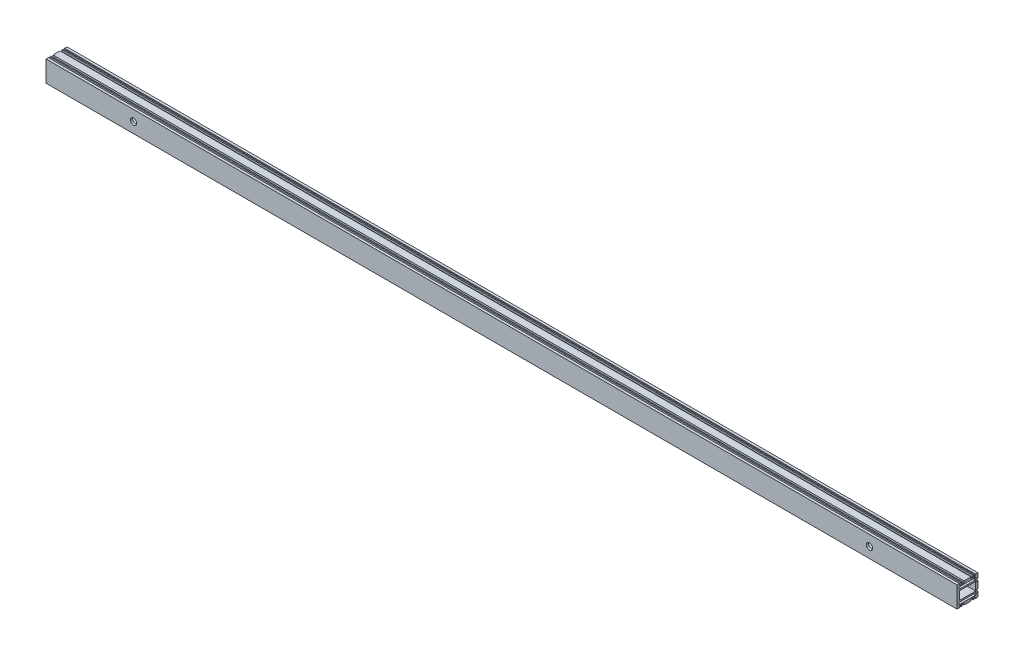
from build123d import *

# Parameters (mm, degrees)
SKETCH_1_W                = 23.5
SKETCH_1_H                = 12
EXTRUDE_1_DEPTH           = 650.5
HOLE_WIZARD_M6_1_D        = 5
HOLE_WIZARD_M6_1_DEPTH    = 19
HOLE_WIZARD_M6_1_TIP      = 1.502151548
HOLE_WIZARD_M6_2_D        = 5
HOLE_WIZARD_M6_2_DEPTH    = 19
HOLE_WIZARD_M6_2_TIP      = 1.502151548
HOLE_WIZARD_9_0_9_1_D     = 9
HOLE_WIZARD_7_0_7_1_D     = 7
HOLE_WIZARD_7_0_7_1_DEPTH = 15
HOLE_WIZARD_7_0_7_1_TIP   = 2.103012167
HOLE_WIZARD_M4_1_D        = 3.3
HOLE_WIZARD_M4_1_DEPTH    = 11.5
HOLE_WIZARD_M4_1_TIP      = 0.991420021


with BuildPart() as part:
    # 草图1 → 凸台-拉伸1 (new, symmetric)
    with BuildSketch(Plane(origin=(0, 0, 0), x_dir=(0, 0, -1), z_dir=(1, 0, 0))):
        Polygon((-15, 15), (-11.5, 15), (-11.5, 13.5), (-11, 13.5), (-11, 12), (-9.5, 12), (-9.5, 15), (-8, 15), (-8, 12.5), (-5, 12.5), (-5, 15), (5, 15), (5, 12.5), (8, 12.5), (8, 15), (9.5, 15), (9.5, 12), (11, 12), (11, 13.5), (11.5, 13.5), (11.5, 15), (15, 15), (15, 8), (12.5, 8), (12.5, 5), (15, 5), (15, -5), (12.5, -5), (12.5, -8), (15, -8), (15, -15), (11.5, -15), (11.5, -13.5), (11, -13.5), (11, -12), (9.5, -12), (9.5, -15), (8, -15), (8, -12.5), (5, -12.5), (5, -15), (-5, -15), (-5, -12.5), (-8, -12.5), (-8, -15), (-9.5, -15), (-9.5, -12), (-11, -12), (-11, -13.5), (-11.5, -13.5), (-11.5, -15), (-15, -15), align=None)
        with BuildLine():
            Line((12, -10.5), (12, -8.5))
            ThreePointArc((12, -8.5), (11.853553391, -8.146446609), (11.5, -8))
            Line((11.5, -8), (-11.5, -8))
            ThreePointArc((-11.5, -8), (-11.853553391, -8.146446609), (-12, -8.5))
            Line((-12, -8.5), (-12, -10.5))
            ThreePointArc((-12, -10.5), (-11.853553391, -10.853553391), (-11.5, -11))
            Line((-11.5, -11), (11.5, -11))
            ThreePointArc((11.5, -11), (11.853553391, -10.853553391), (12, -10.5))
        make_face(mode=Mode.SUBTRACT)
        with BuildLine():
            Line((-11.5, 11), (11.5, 11))
            ThreePointArc((11.5, 11), (11.853553391, 10.853553391), (12, 10.5))
            Line((12, 10.5), (12, 8.5))
            ThreePointArc((12, 8.5), (11.853553391, 8.146446609), (11.5, 8))
            Line((11.5, 8), (-11.5, 8))
            ThreePointArc((-11.5, 8), (-11.853553391, 8.146446609), (-12, 8.5))
            Line((-12, 8.5), (-12, 10.5))
            ThreePointArc((-12, 10.5), (-11.853553391, 10.853553391), (-11.5, 11))
        make_face(mode=Mode.SUBTRACT)
        Rectangle(SKETCH_1_W, SKETCH_1_H, mode=Mode.SUBTRACT)
    extrude(amount=EXTRUDE_1_DEPTH, both=True)

    # M6 螺纹孔1
    with Locations(Plane(origin=(0, 0, -15), x_dir=(-1, 0, 0), z_dir=(0, 0, -1))):
        with Locations((630.5, 0), (615.5, 0), (-327.5, 0), (-342.5, 0), (-412.5, 0), (-427.5, 0), (-615.5, 0), (-630.5, 0), (-570.5, 0), (-472.5, 0)):
            Hole(HOLE_WIZARD_M6_1_D / 2, depth=HOLE_WIZARD_M6_1_DEPTH)
            with Locations((0, 0, -(HOLE_WIZARD_M6_1_DEPTH + HOLE_WIZARD_M6_1_TIP / 2))):  # 118° drill point
                Cone(0, HOLE_WIZARD_M6_1_D / 2, HOLE_WIZARD_M6_1_TIP, mode=Mode.SUBTRACT)

    # M6 螺纹孔2
    with Locations(Plane(origin=(0, -15, 0), x_dir=(-1, 0, 0), z_dir=(0, -1, 0))):
        with Locations((-630.5, 0), (-615.5, 0), (615.5, 0), (630.5, 0), (-137.5, 0), (-83.5, 0), (157.5, 0), (211.5, 0)):
            Hole(HOLE_WIZARD_M6_2_D / 2, depth=HOLE_WIZARD_M6_2_DEPTH)
            with Locations((0, 0, -(HOLE_WIZARD_M6_2_DEPTH + HOLE_WIZARD_M6_2_TIP / 2))):  # 118° drill point
                Cone(0, HOLE_WIZARD_M6_2_D / 2, HOLE_WIZARD_M6_2_TIP, mode=Mode.SUBTRACT)

    # Ø9.0 (9) 直径孔1 (through all)
    with Locations(Plane.XY.offset(15)):
        with Locations((525.5, 0), (-525.5, 0)):
            Hole(HOLE_WIZARD_9_0_9_1_D / 2)

    # Ø7.0 (7) 直径孔1
    with Locations(Plane(origin=(0, 0, -15), x_dir=(-1, 0, 0), z_dir=(0, 0, -1))):
        with Locations((-111, 0), (399, 0)):
            Hole(HOLE_WIZARD_7_0_7_1_D / 2, depth=HOLE_WIZARD_7_0_7_1_DEPTH)
            with Locations((0, 0, -(HOLE_WIZARD_7_0_7_1_DEPTH + HOLE_WIZARD_7_0_7_1_TIP / 2))):  # 118° drill point
                Cone(0, HOLE_WIZARD_7_0_7_1_D / 2, HOLE_WIZARD_7_0_7_1_TIP, mode=Mode.SUBTRACT)

    # M4 螺纹孔1
    with Locations(Plane(origin=(0, -15, 0), x_dir=(-1, 0, 0), z_dir=(0, -1, 0))):
        with Locations((-540.5, 0), (-280.5, 0)):
            Hole(HOLE_WIZARD_M4_1_D / 2, depth=HOLE_WIZARD_M4_1_DEPTH)
            with Locations((0, 0, -(HOLE_WIZARD_M4_1_DEPTH + HOLE_WIZARD_M4_1_TIP / 2))):  # 118° drill point
                Cone(0, HOLE_WIZARD_M4_1_D / 2, HOLE_WIZARD_M4_1_TIP, mode=Mode.SUBTRACT)


solid = part.part
